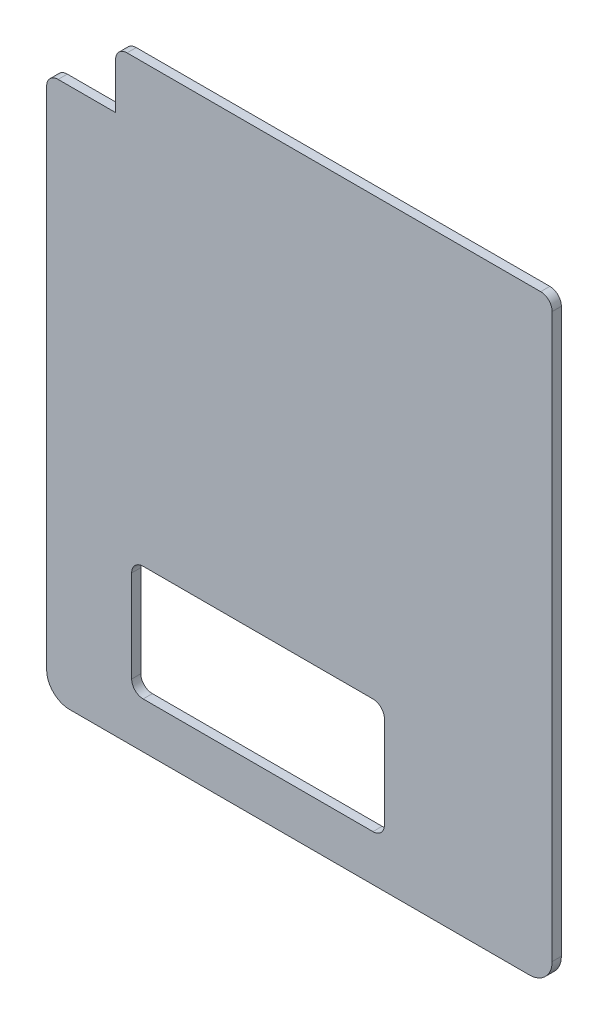
from build123d import *

# Parameters (mm, degrees)
AUFSATZ_LINEAR_AUSTRAGEN1_DEPTH = 0.4
SKIZZE2_W                       = 11
SKIZZE2_H                       = 5
SCHNITT_LINEAR_AUSTRAGEN1_DEPTH = 0.4
VERRUNDUNG1_R                   = 0.5
VERRUNDUNG2_R                   = 1


with BuildPart() as part:
    # Skizze1 → Aufsatz-Linear austragen1 (new body)
    with BuildSketch(Plane.XY):
        Polygon((0, 0), (-19, 0), (-19, -2.5), (-22, -2.5), (-22, -26), (0, -26), align=None)
    extrude(amount=AUFSATZ_LINEAR_AUSTRAGEN1_DEPTH)

    # Skizze2 → Schnitt-Linear austragen1 (cut)
    with BuildSketch(Plane.XY):
        with Locations((-12.8, -21.5)):
            Rectangle(SKIZZE2_W, SKIZZE2_H)
    extrude(amount=SCHNITT_LINEAR_AUSTRAGEN1_DEPTH, mode=Mode.SUBTRACT)

    # Verrundung1
    verrundung1_edges = [part.edges().sort_by_distance(p)[0] for p in [
        (-22, -2.5, 0.2),
        (-19, 0, 0.2),
        (0, 0, 0.2),
        (-18.3, -19, 0.2),
        (-18.3, -24, 0.2),
        (-7.3, -24, 0.2),
        (-7.3, -19, 0.2),
    ]]
    fillet(verrundung1_edges, radius=VERRUNDUNG1_R)

    # Verrundung2
    verrundung2_edges = [part.edges().sort_by_distance(p)[0] for p in [
        (0, -26, 0.2),
        (-22, -26, 0.2),
    ]]
    fillet(verrundung2_edges, radius=VERRUNDUNG2_R)


solid = part.part
